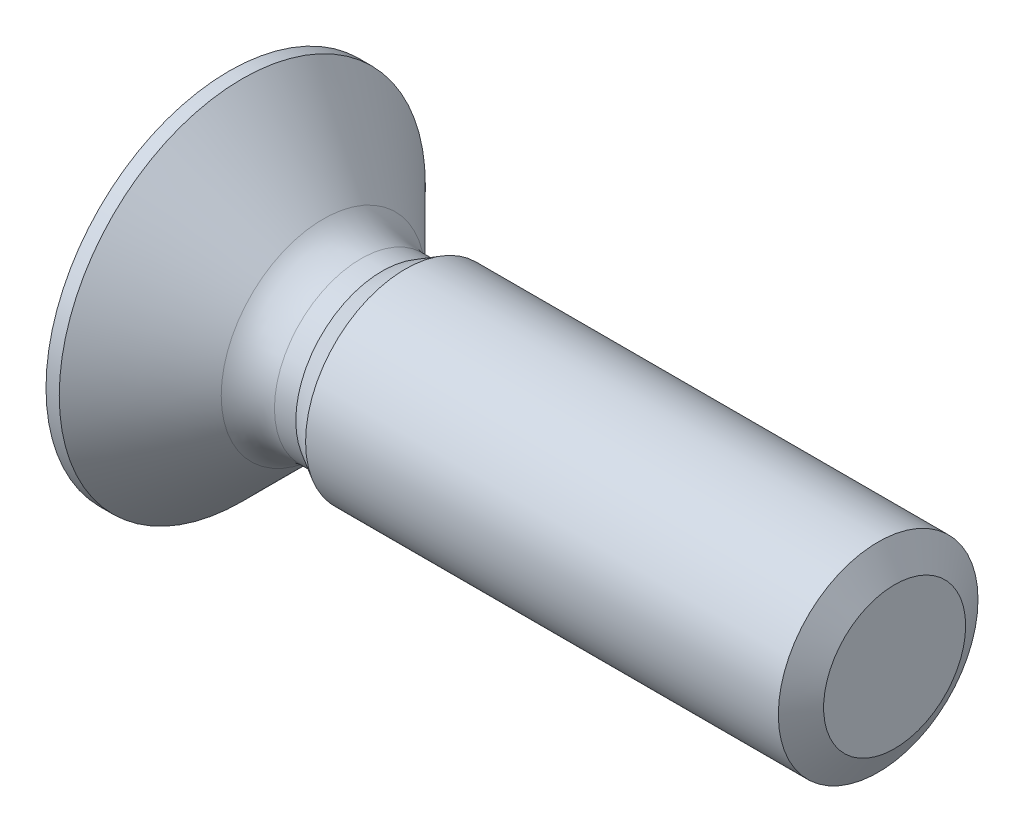
from build123d import *

# Parameters (mm, degrees)
PATTERN_CIRCULAR_1_COUNT = 2
PATTERN_CIRCULAR_1_ANGLE = 90


with BuildPart() as part:
    # 草图1 → Revolve 694 (revolve)
    with BuildSketch(Plane.XY, mode=Mode.PRIVATE) as revolve_694_sk:
        with BuildLine():
            Line((0, 0), (0, 2.75))
            Line((0, 2.75), (0.199, 2.75))
            Line((0.199, 2.75), (1.415685425, 1.533314575))
            ThreePointArc((1.415685425, 1.533314575), (1.675224104, 1.359896374), (1.98137085, 1.299))
            Line((1.98137085, 1.299), (2.301857788, 1.299))
            Line((2.301857788, 1.299), (2.65, 1.5))
            Line((2.65, 1.5), (10, 1.5))
            Line((10, 1.5), (10, 0))
            Line((10, 0), (0, 0))
        make_face()
    revolve(revolve_694_sk.sketch.rotate(Axis((0, 0, 0), (1, 0, 0)), 90), axis=Axis((0, 0, 0), (1, 0, 0)))

    # 草图2 → 切除-旋转1 (revolve, cut)
    with BuildSketch(Plane.XY, mode=Mode.PRIVATE) as cut_revolve_1_sk:
        Polygon((9.752708003, 1.5), (10.252708003, 1.5), (10, 1.067), align=None)
    revolve(cut_revolve_1_sk.sketch.rotate(Axis((0, 0, 0), (-1, 0, 0)), 270), axis=Axis((0, 0, 0), (-1, 0, 0)), mode=Mode.SUBTRACT)

    # 草图3 → 切除-放样1 section 0
    with BuildSketch(Plane.ZY, mode=Mode.PRIVATE) as loft_1_s0:
        with BuildLine():
            Line((-1.6, 0.25), (1.6, 0.25))
            Line((1.6, 0.25), (1.6, -0.25))
            Line((1.6, -0.25), (-1.6, -0.25))
            Line((-1.6, -0.25), (-1.6, 0.25))
        make_face()
    loft_1 = loft([loft_1_s0.sketch, Vertex(2.1, 0, 0)], mode=Mode.SUBTRACT)

    # 阵列(圆周)1: 切除-放样1 ×2 about axis
    pattern_circular_1_axis = Axis((0, 0, 0), (1, 0, 0))
    for i in range(1, PATTERN_CIRCULAR_1_COUNT):
        add(loft_1.rotate(pattern_circular_1_axis, i * PATTERN_CIRCULAR_1_ANGLE / (PATTERN_CIRCULAR_1_COUNT - 1)), mode=Mode.SUBTRACT)


solid = part.part
